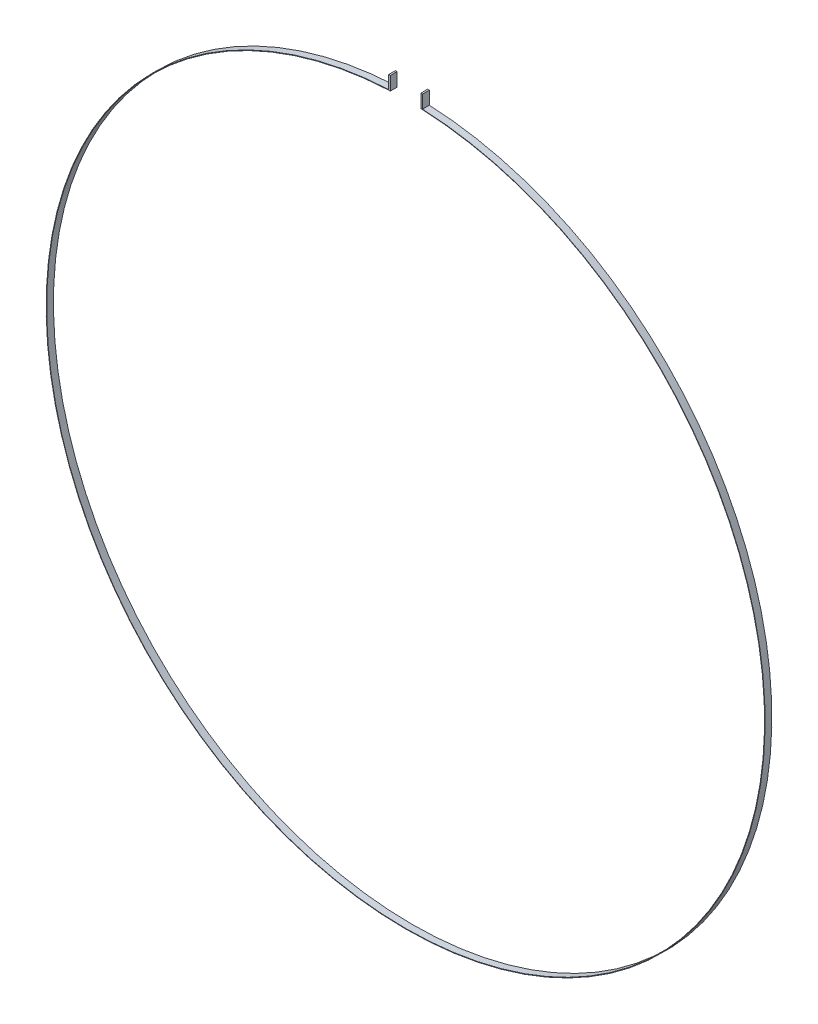
from build123d import *

# Parameters (mm, degrees)
SKETCH1_R           = 1061.5
SKETCH1_R_2         = 1060
BOSS_EXTRUDE1_DEPTH = 20
SKETCH2_W           = 100
SKETCH2_H           = 40
BOSS_EXTRUDE2_DEPTH = 20
SKETCH3_W           = 90
SKETCH3_H           = 856.926070381
CUT_EXTRUDE1_DEPTH  = 40


with BuildPart() as part:
    # Sketch1 → Boss-Extrude1 (new body)
    with BuildSketch(Plane.XY):
        Circle(SKETCH1_R)
        Circle(SKETCH1_R_2, mode=Mode.SUBTRACT)
    extrude(amount=BOSS_EXTRUDE1_DEPTH)

    # Sketch2 → Boss-Extrude2 (add)
    with BuildSketch(Plane.XY):
        with Locations((0, 1078.820098034)):
            Rectangle(SKETCH2_W, SKETCH2_H)
    extrude(amount=BOSS_EXTRUDE2_DEPTH)

    # Sketch3 → Cut-Extrude1 (cut)
    with BuildSketch(Plane.XY.offset(20)):
        with Locations((0, 1370.93039413)):
            Rectangle(SKETCH3_W, SKETCH3_H)
    extrude(amount=-CUT_EXTRUDE1_DEPTH, mode=Mode.SUBTRACT)


solid = part.part
